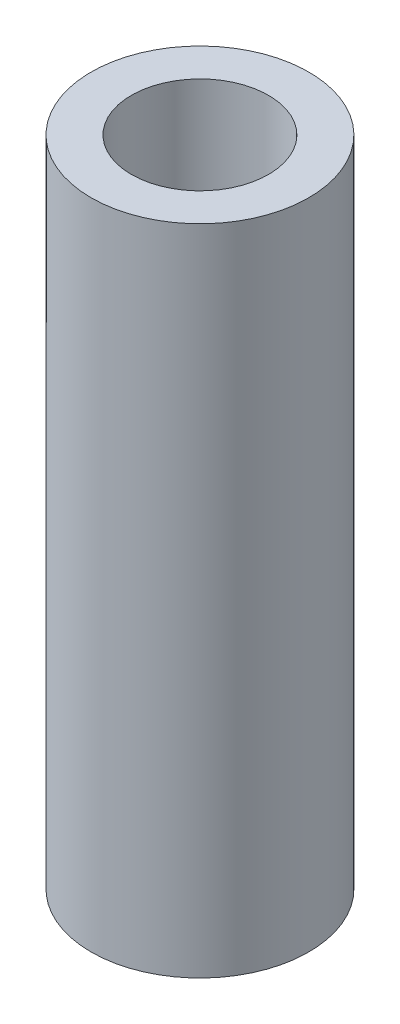
from build123d import *

# Parameters (mm, degrees)
SKETCH1_R           = 3.175
SKETCH1_R_2         = 2
BOSS_EXTRUDE1_DEPTH = 19.05


with BuildPart() as part:
    # Sketch1 → Boss-Extrude1 (new body)
    with BuildSketch(Plane(origin=(0, 0, 0), x_dir=(1, 0, 0), z_dir=(0, 1, 0))):
        with Locations(Location((0, 0, 0), (0, 0, 270))):
            Circle(SKETCH1_R)
        with Locations(Location((0, 0, 0), (0, 0, 270))):
            Circle(SKETCH1_R_2, mode=Mode.SUBTRACT)
    extrude(amount=-BOSS_EXTRUDE1_DEPTH)


solid = part.part
